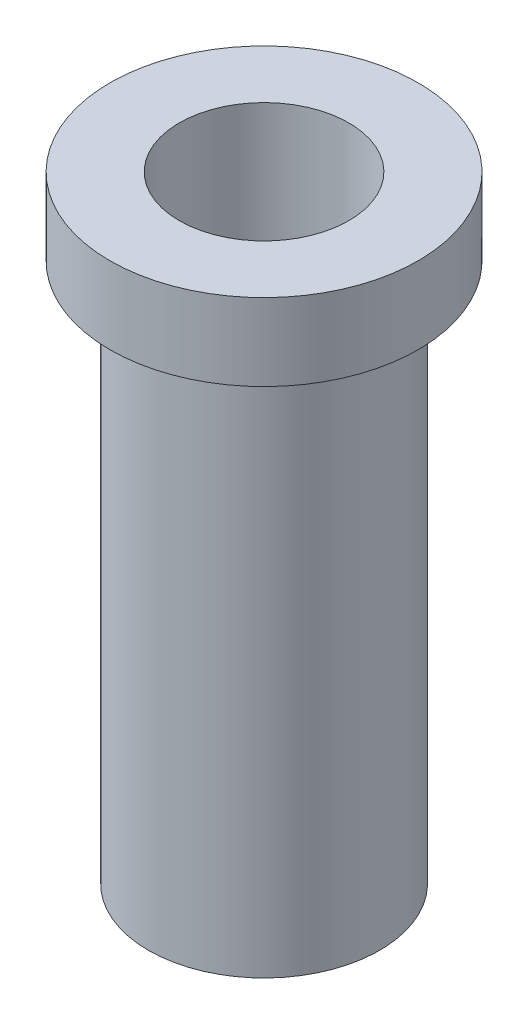
from build123d import *

# Parameters (mm, degrees)
SKETCH2_R           = 7.5
BOSS_EXTRUDE4_DEPTH = 40
SKETCH5_R           = 10
BOSS_EXTRUDE5_DEPTH = 5
SKETCH6_R           = 5.5
CUT_EXTRUDE2_DEPTH  = 43.426406871


with BuildPart() as part:
    # Sketch2 → Boss-Extrude4 (new body)
    with BuildSketch(Plane(origin=(0, 0, 0), x_dir=(1, 0, 0), z_dir=(0, 1, 0))):
        with Locations(Location((0, 0, 0), (0, 0, 270))):
            Circle(SKETCH2_R)
    extrude(amount=-BOSS_EXTRUDE4_DEPTH)

    # Sketch5 → Boss-Extrude5 (add)
    with BuildSketch(Plane(origin=(0, 0, 0), x_dir=(1, 0, 0), z_dir=(0, 1, 0))):
        with Locations(Location((0, 0, 0), (0, 0, 270))):
            Circle(SKETCH5_R)
    extrude(amount=-BOSS_EXTRUDE5_DEPTH)

    # Sketch6 → Cut-Extrude2 (cut, through all)
    with BuildSketch(Plane(origin=(0, 0, 0), x_dir=(1, 0, 0), z_dir=(0, 1, 0))):
        with Locations(Location((0, 0, 0), (0, 0, 270))):
            Circle(SKETCH6_R)
    extrude(amount=-CUT_EXTRUDE2_DEPTH, mode=Mode.SUBTRACT)


solid = part.part
